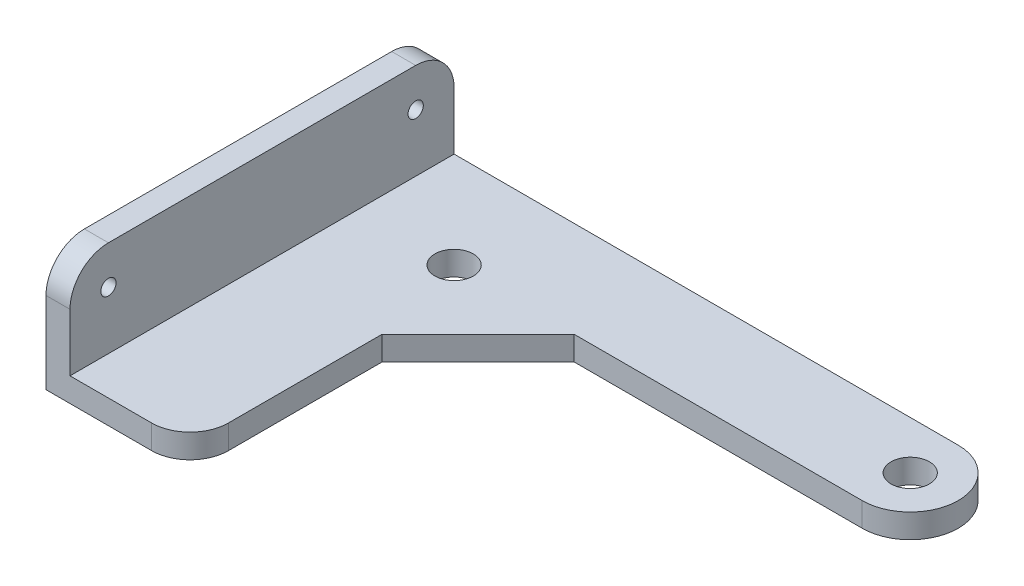
from build123d import *

# Parameters (mm, degrees)
BOSS_EXTRUDE2_DEPTH = 25
SKETCH1_4_W         = 25
SKETCH1_4_H         = 400
BOSS_EXTRUDE3_DEPTH = 125
FILLET1_R           = 40
SKETCH2_R           = 20
CUT_EXTRUDE1_DEPTH  = 729.010988928
FILLET2_R           = 40
SKETCH3_R           = 7.94
CUT_EXTRUDE2_DEPTH  = 712.512473538


with BuildPart() as part:
    # Sketch1 → Boss-Extrude2 (new body)
    with BuildSketch(Plane(origin=(0, 0, 0), x_dir=(1, 0, 0), z_dir=(0, 1, 0))):
        with BuildLine():
            Line((25, 400), (25, 0))
            Line((25, 0), (150, 0))
            Line((150, 0), (150, 200))
            Line((150, 200), (250, 300))
            Line((250, 300), (550, 300))
            ThreePointArc((550, 300), (600, 350), (550, 400))
            Line((550, 400), (25, 400))
        make_face()
    extrude(amount=BOSS_EXTRUDE2_DEPTH)

    # Sketch1<4> → Boss-Extrude3 (add)
    with BuildSketch(Plane(origin=(0, 0, 0), x_dir=(1, 0, 0), z_dir=(0, 1, 0))):
        with Locations((12.5, 200)):
            Rectangle(SKETCH1_4_W, SKETCH1_4_H)
    extrude(amount=BOSS_EXTRUDE3_DEPTH)

    # Fillet1
    fillet1_edges = [part.edges().sort_by_distance(p)[0] for p in [
        (150, 12.5, 0),
    ]]
    fillet(fillet1_edges, radius=FILLET1_R)

    # Sketch2 → Cut-Extrude1 (cut, through all)
    with BuildSketch(Plane(origin=(0, 25, 0), x_dir=(1, 0, 0), z_dir=(0, 1, 0))):
        with Locations((550, 350)):
            Circle(SKETCH2_R)
        with Locations((125, 300)):
            Circle(SKETCH2_R)
    extrude(amount=-CUT_EXTRUDE1_DEPTH, mode=Mode.SUBTRACT)

    # Fillet2
    fillet2_edges = [part.edges().sort_by_distance(p)[0] for p in [
        (12.5, 125, 0),
        (12.5, 125, -400),
    ]]
    fillet(fillet2_edges, radius=FILLET2_R)

    # Sketch3 → Cut-Extrude2 (cut, through all)
    with BuildSketch(Plane(origin=(25, 0, 0), x_dir=(0, 0, -1), z_dir=(1, 0, 0))):
        with Locations((40, 85)):
            Circle(SKETCH3_R)
        with Locations((360, 85)):
            Circle(SKETCH3_R)
    extrude(amount=-CUT_EXTRUDE2_DEPTH, mode=Mode.SUBTRACT)


solid = part.part
